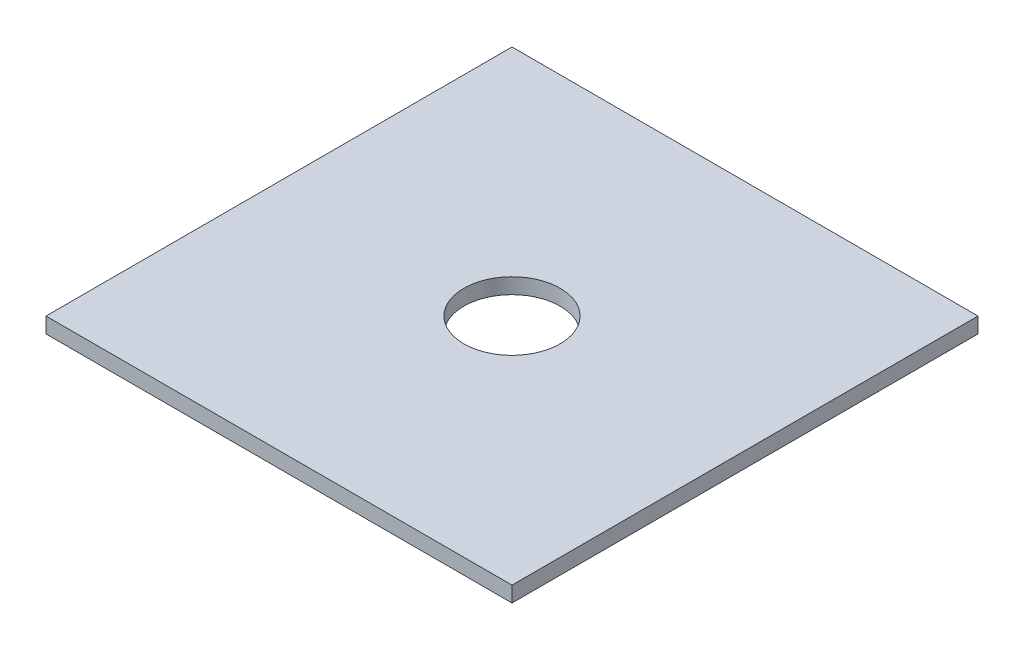
from build123d import *

# Parameters (mm, degrees)
SKETCH2_W                = 30
SKETCH2_H                = 30
BOSS_EXTRUDE1_DEPTH      = 10
SKETCH3_W                = 30
SKETCH3_H                = 30
SKETCH3_W_2              = 25
SKETCH3_H_2              = 25
BOSS_EXTRUDE2_DEPTH      = 15
SKETCH4_W                = 30
SKETCH4_H                = 30
BOSS_EXTRUDE3_DEPTH      = 15
CUT_EXTRUDE1_START       = -40
SKETCH5_R                = 3.05
CUT_EXTRUDE1_DEPTH       = 40
BOSS_EXTRUDE4_DEPTH      = 10
BOSS_EXTRUDE4_DEPTH_BACK = 40
SKETCH6_W                = 7.5
SKETCH6_H                = 1.017843133
SKETCH6_H_2              = 1.2761833
SKETCH7_R                = 2.76
CUT_EXTRUDE2_DEPTH       = 10
SKETCH8_W                = 30
SKETCH8_H                = 30
BOSS_EXTRUDE5_DEPTH      = 1
SKETCH9_R                = 3.1
CUT_EXTRUDE3_DEPTH       = 1


with BuildPart() as part:
    # Sketch2 → Boss-Extrude1 (new body)
    with BuildSketch(Plane(origin=(0, 0, 0), x_dir=(1, 0, 0), z_dir=(0, 1, 0))):
        Rectangle(SKETCH2_W, SKETCH2_H)
    extrude(amount=BOSS_EXTRUDE1_DEPTH)


with BuildPart() as body_2:
    # Sketch3 → Boss-Extrude2 (new body)
    with BuildSketch(Plane(origin=(0, 10, 0), x_dir=(1, 0, 0), z_dir=(0, 1, 0))):
        Rectangle(SKETCH3_W, SKETCH3_H)
        Rectangle(SKETCH3_W_2, SKETCH3_H_2, mode=Mode.SUBTRACT)
    extrude(amount=BOSS_EXTRUDE2_DEPTH)


with BuildPart() as body_3:
    # Sketch4 → Boss-Extrude3 (new body)
    with BuildSketch(Plane(origin=(0, 25, 0), x_dir=(1, 0, 0), z_dir=(0, 1, 0))):
        Rectangle(SKETCH4_W, SKETCH4_H)
    extrude(amount=BOSS_EXTRUDE3_DEPTH)


with BuildPart() as cut_extrude1_tool:
    # Sketch5 → Cut-Extrude1 (new body)
    with BuildSketch(Plane(origin=(0, 40, 0), x_dir=(1, 0, 0), z_dir=(0, 1, 0)).offset(CUT_EXTRUDE1_START)):
        with Locations(Location((0, 0, 0), (0, 0, 270))):
            Circle(SKETCH5_R)
    extrude(amount=CUT_EXTRUDE1_DEPTH)


with BuildPart() as part_1:
    add(part.part)

    # Cut-Extrude1: cut by cut_extrude1_tool
    add(cut_extrude1_tool.part, mode=Mode.SUBTRACT)


with BuildPart() as body_3_1:
    add(body_3.part)

    # Cut-Extrude1: cut by cut_extrude1_tool
    add(cut_extrude1_tool.part, mode=Mode.SUBTRACT)

    # Sketch6 → Boss-Extrude4 (add, two sides: drawn at the far end of the back side and taken through both)
    with BuildSketch(Plane(origin=(0, 0, -15), x_dir=(-1, 0, 0), z_dir=(0, 0, -1)).offset(-BOSS_EXTRUDE4_DEPTH_BACK)):
        with Locations((-11.25, 25.508921566)):
            Rectangle(SKETCH6_W, SKETCH6_H)
        with Locations((11.25, 25.63809165)):
            Rectangle(SKETCH6_W, SKETCH6_H_2)
    extrude(amount=BOSS_EXTRUDE4_DEPTH + BOSS_EXTRUDE4_DEPTH_BACK)

    # Sketch7 → Cut-Extrude2 (cut)
    with BuildSketch(Plane(origin=(0, 26.2761833, 0), x_dir=(1, 0, 0), z_dir=(0, 1, 0))):
        with Locations(Location((-11.25, 20, 0), (0, 0, 270))):
            Circle(SKETCH7_R)
        with Locations(Location((11.25, 20, 0), (0, 0, 270))):
            Circle(SKETCH7_R)
        with Locations(Location((11.25, -20.5, 0), (0, 0, 270))):
            Circle(SKETCH7_R)
        with Locations(Location((-11.25, -20.5, 0), (0, 0, 270))):
            Circle(SKETCH7_R)
    extrude(amount=-CUT_EXTRUDE2_DEPTH, mode=Mode.SUBTRACT)


with BuildPart() as body_2_2:
    # Sketch8 → Boss-Extrude5 (new body)
    with BuildSketch(Plane(origin=(0, 40, 0), x_dir=(1, 0, 0), z_dir=(0, 1, 0))):
        Rectangle(SKETCH8_W, SKETCH8_H)
    extrude(amount=BOSS_EXTRUDE5_DEPTH)

    # Sketch9 → Cut-Extrude3 (cut)
    with BuildSketch(Plane(origin=(0, 41, 0), x_dir=(1, 0, 0), z_dir=(0, 1, 0))):
        with Locations(Location((0, 0, 0), (0, 0, 270))):
            Circle(SKETCH9_R)
    extrude(amount=-CUT_EXTRUDE3_DEPTH, mode=Mode.SUBTRACT)


solid = body_2_2.part
